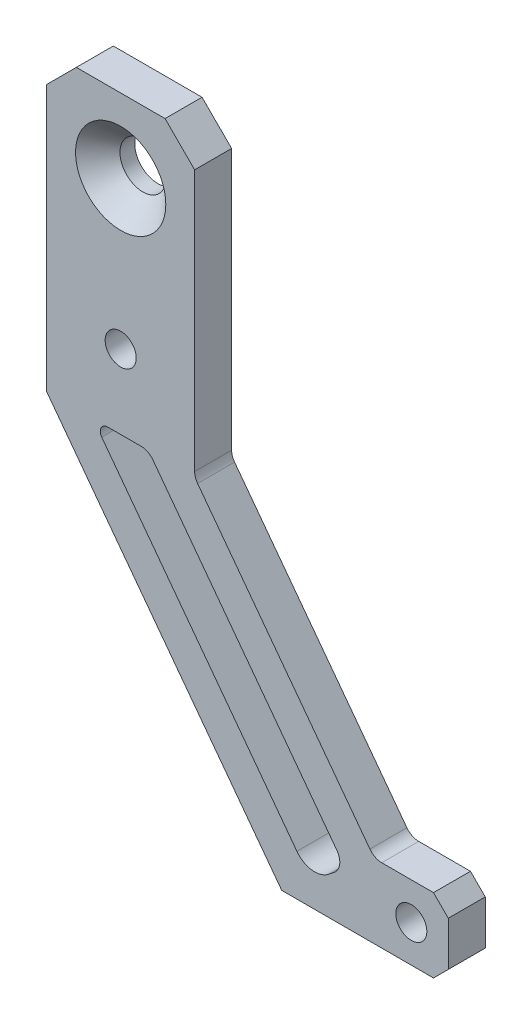
from build123d import *

# Parameters (mm, degrees)
SKETCH_1_R          = 2.1
SKETCH_1_R_2        = 3.1
EXTRUDE_1_DEPTH     = 2.5
FILLET_1_R          = 2
FILLET_2_R          = 3
CHAMFER_1_SIZE      = 4
CHAMFER_2_SIZE      = 2
FILLET_3_R          = 1
SKETCH_2_R          = 2.1
CUT_EXTRUDE_1_DEPTH = 5
CHAMFER_3_SIZE      = 3


with BuildPart() as part:
    # 草图1 → 凸台-拉伸1 (new, symmetric)
    with BuildSketch(Plane.XY):
        Polygon((-10, 10), (-10, -30), (21.776923077, -72.5), (44.3, -72.5), (44.3, -62.5), (34.3, -62.5), (10, -30), (10, 10), align=None)
        with Locations((39.3, -67.5)):
            Circle(SKETCH_1_R, mode=Mode.SUBTRACT)
        Circle(SKETCH_1_R_2, mode=Mode.SUBTRACT)
        Polygon((-3.756916253, -30), (3.756916253, -30), (30.3908691, -65.621541874), (25.686053977, -69.378458126), align=None, mode=Mode.SUBTRACT)
    extrude(amount=EXTRUDE_1_DEPTH, both=True)

    # 圆角1
    fillet_1_edges = [part.edges().sort_by_distance(p)[0] for p in [
        (10, -30, 0),
        (34.3, -62.5, 0),
        (30.3908691, -65.621541874, 0),
        (3.756916253, -30, 0),
    ]]
    fillet(fillet_1_edges, radius=FILLET_1_R)

    # 圆角2
    fillet_2_edges = [part.edges().sort_by_distance(p)[0] for p in [
        (25.686053977, -69.378458126, 0),
    ]]
    fillet(fillet_2_edges, radius=FILLET_2_R)

    # 倒角1
    chamfer_1_edges = [part.edges().sort_by_distance(p)[0] for p in [
        (10, 10, 0),
        (-10, 10, 0),
    ]]
    chamfer(chamfer_1_edges, length=CHAMFER_1_SIZE)

    # 倒角2
    chamfer_2_edges = [part.edges().sort_by_distance(p)[0] for p in [
        (44.3, -62.5, 0),
        (44.3, -72.5, 0),
    ]]
    chamfer(chamfer_2_edges, length=CHAMFER_2_SIZE)

    # 圆角3
    fillet_3_edges = [part.edges().sort_by_distance(p)[0] for p in [
        (-3.756916253, -30, 0),
    ]]
    fillet(fillet_3_edges, radius=FILLET_3_R)

    # 草图2 → 切除-拉伸1 (cut)
    with BuildSketch(Plane.XY.offset(2.5)):
        with Locations((0, -20)):
            Circle(SKETCH_2_R)
    extrude(amount=-CUT_EXTRUDE_1_DEPTH, mode=Mode.SUBTRACT)

    # 倒角3
    chamfer_3_edges = [part.edges().sort_by_distance(p)[0] for p in [
        (-3.1, 0, 2.5),
    ]]
    chamfer(chamfer_3_edges, length=CHAMFER_3_SIZE)


solid = part.part
